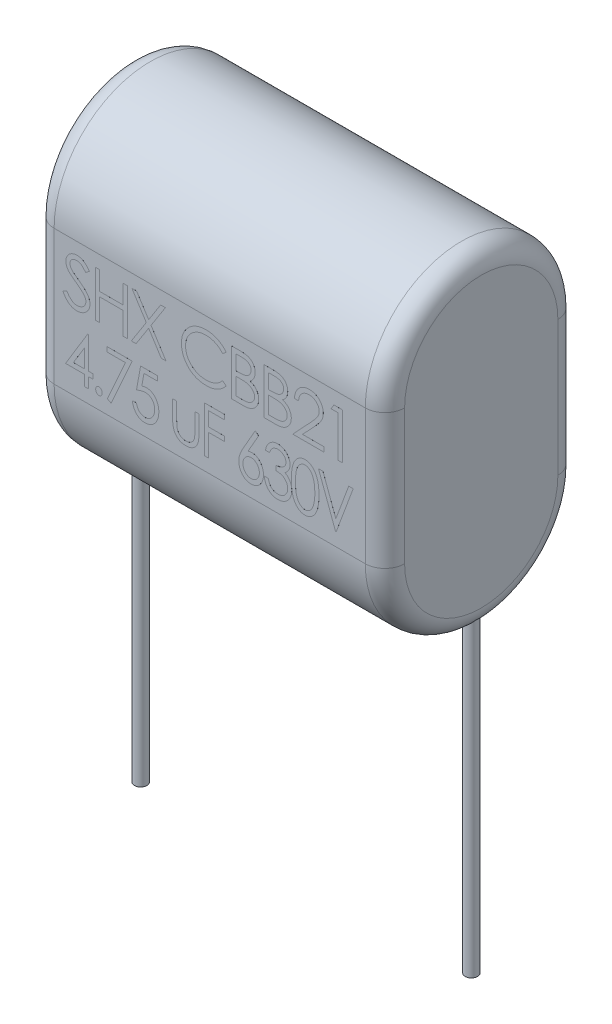
from build123d import *

# Parameters (mm, degrees)
BOSS_EXTRUDE1_DEPTH = 13.375
FILLET1_R           = 1.5
SKETCH2_R           = 0.47
BOSS_EXTRUDE3_DEPTH = 35.5
BOSS_EXTRUDE4_START = 7.35
BOSS_EXTRUDE4_DEPTH = 0.001


with BuildPart() as part:
    # Sketch1 → Boss-Extrude1 (new, symmetric)
    with BuildSketch(Plane(origin=(0, 0, 0), x_dir=(0, 0, -1), z_dir=(1, 0, 0))):
        with BuildLine():
            Line((7.35, 5.15), (7.35, -5.15))
            ThreePointArc((7.35, -5.15), (0, -12.5), (-7.35, -5.15))
            Line((-7.35, -5.15), (-7.35, 5.15))
            ThreePointArc((-7.35, 5.15), (0, 12.5), (7.35, 5.15))
        make_face()
    extrude(amount=BOSS_EXTRUDE1_DEPTH, both=True)

    # Fillet1
    fillet1_edges = [part.edges().sort_by_distance(p)[0] for p in [
        (13.375, -12.5, 0),
        (13.375, 0, -7.35),
        (13.375, 12.5, 0),
        (-13.375, 0, -7.35),
        (-13.375, -12.5, 0),
        (-13.375, 0, 7.35),
        (-13.375, 12.5, 0),
        (13.375, 0, 7.35),
    ]]
    fillet(fillet1_edges, radius=FILLET1_R)

    # Sketch2 → Boss-Extrude3 (add)
    with BuildSketch(Plane(origin=(0, 0, 0), x_dir=(1, 0, 0), z_dir=(0, 1, 0))):
        with Locations(Location((-12.62, 0, 0), (0, 0, 270))):
            Circle(SKETCH2_R)
        with Locations(Location((12.62, 0, 0), (0, 0, 129.320389194))):
            Circle(SKETCH2_R)
    extrude(amount=-BOSS_EXTRUDE3_DEPTH)

    # Sketch3 → Boss-Extrude4 (add)
    # profile 1 of 18: a face of its own
    with BuildSketch(Plane.XY.offset(BOSS_EXTRUDE4_START)):
        with BuildLine():
            Line((-11.2, 1.325180288), (-10.904126603, 1.502564103))
            add(Edge.make_bspline(
                [(-10.904126603, 1.502564103), (-10.876608365, 1.456499718), (-10.823884485, 1.368242134), (-10.735933126, 1.248984093), (-10.644800214, 1.147621937), (-10.549810881, 1.064745329), (-10.451544933, 0.999496442), (-10.349360879, 0.953294211), (-10.243603068, 0.924478235), (-10.171629247, 0.920978149), (-10.135697115, 0.919230769)],
                knots=[0, 0, 0, 0, 1.272034388, 2.437168799, 3.508375237, 4.49857839, 5.41946034, 6.295179144, 7.148887113, 8, 8, 8, 8], degree=3))
            add(Edge.make_bspline(
                [(-10.135697115, 0.919230769), (-10.105010255, 0.920085442), (-10.044173482, 0.921779832), (-9.954611239, 0.938060634), (-9.867629437, 0.963072763), (-9.785020799, 0.998893694), (-9.707925184, 1.04223218), (-9.640318489, 1.094578358), (-9.581872376, 1.153184563), (-9.534063261, 1.218567218), (-9.497383226, 1.288884367), (-9.469191158, 1.361060318), (-9.453546084, 1.436228886), (-9.45118933, 1.486839349), (-9.45, 1.512379808)],
                knots=[0, 0, 0, 0, 1.095163259, 2.171163733, 3.241058638, 4.321873601, 5.38011039, 6.391990106, 7.366004449, 8.327778327, 9.272591725, 10.192022065, 11.087607919, 12, 12, 12, 12], degree=3))
            add(Edge.make_bspline(
                [(-9.45, 1.512379808), (-9.451474311, 1.541520657), (-9.454471369, 1.600759747), (-9.479802849, 1.6881594), (-9.519652096, 1.77465197), (-9.55641474, 1.828153235), (-9.575500801, 1.855929487)],
                knots=[0, 0, 0, 0, 0.938893495, 1.908633276, 2.914225137, 4, 4, 4, 4], degree=3))
            add(Edge.make_bspline(
                [(-9.575500801, 1.855929487), (-9.591171415, 1.875976311), (-9.62406991, 1.918062109), (-9.680627422, 1.980707345), (-9.746993537, 2.045325764), (-9.820897092, 2.114384821), (-9.90503018, 2.184672617), (-9.996757695, 2.259540895), (-10.098421554, 2.336142472), (-10.16972105, 2.387515038), (-10.206510417, 2.414022436)],
                knots=[0, 0, 0, 0, 0.722233717, 1.516239348, 2.393582979, 3.351407094, 4.387010283, 5.505090956, 6.712668013, 8, 8, 8, 8], degree=3))
            add(Edge.make_bspline(
                [(-10.206510417, 2.414022436), (-10.243334413, 2.440251024), (-10.313739089, 2.490398086), (-10.412197672, 2.56482237), (-10.500242135, 2.632866239), (-10.577481151, 2.695170251), (-10.643880748, 2.751742856), (-10.699964159, 2.802040795), (-10.744302716, 2.847424356), (-10.768958297, 2.876865698), (-10.780028045, 2.890084135)],
                knots=[0, 0, 0, 0, 1.452282411, 2.77665338, 3.964542531, 5.026858415, 5.96415736, 6.766646006, 7.446254459, 8, 8, 8, 8], degree=3))
            add(Edge.make_bspline(
                [(-10.780028045, 2.890084135), (-10.79550059, 2.910685171), (-10.825929427, 2.951199875), (-10.866095432, 3.014524733), (-10.900234595, 3.079347998), (-10.926996927, 3.145843863), (-10.949533146, 3.213078792), (-10.964691077, 3.281930038), (-10.974182474, 3.352088656), (-10.97515446, 3.399302157), (-10.975641026, 3.422936699)],
                knots=[0, 0, 0, 0, 1.068054152, 2.10047183, 3.106115577, 4.101338837, 5.06977816, 6.043150881, 7.020423561, 8, 8, 8, 8], degree=3))
            add(Edge.make_bspline(
                [(-10.975641026, 3.422936699), (-10.974335817, 3.459966473), (-10.971753297, 3.533234537), (-10.949912779, 3.640265367), (-10.915439886, 3.742451785), (-10.867144998, 3.838782118), (-10.804887645, 3.926748099), (-10.732841671, 4.007361586), (-10.647030184, 4.075130168), (-10.552877561, 4.134342227), (-10.449821189, 4.180688152), (-10.341830286, 4.215649132), (-10.228733214, 4.23545839), (-10.152130079, 4.238301155), (-10.113261218, 4.23974359)],
                knots=[0, 0, 0, 0, 1.005424448, 1.989358655, 2.955360095, 3.929531133, 4.905563448, 5.876582895, 6.856512386, 7.866279853, 8.892233794, 9.918561126, 10.94386622, 12, 12, 12, 12], degree=3))
            add(Edge.make_bspline(
                [(-10.113261218, 4.23974359), (-10.072017118, 4.238321038), (-9.989995766, 4.235492037), (-9.86934655, 4.210894506), (-9.753185834, 4.170193834), (-9.659742569, 4.124005176), (-9.586609808, 4.07787376), (-9.530837075, 4.035853936), (-9.474319624, 3.987478827), (-9.416601569, 3.932619581), (-9.35866091, 3.87077283), (-9.299637458, 3.802362141), (-9.239393189, 3.727805585), (-9.200637329, 3.674581085), (-9.180769231, 3.647295673)],
                knots=[0, 0, 0, 0, 1.286793592, 2.559021753, 3.825965368, 5.121522368, 5.803751409, 6.523245864, 7.299691795, 8.125521123, 9.008227632, 9.944561021, 10.946284179, 12, 12, 12, 12], degree=3))
            Line((-9.180769231, 3.647295673), (-9.464723558, 3.432051282))
            add(Edge.make_bspline(
                [(-9.464723558, 3.432051282), (-9.48186949, 3.454139972), (-9.514888547, 3.496677626), (-9.565018034, 3.556248941), (-9.612266682, 3.610665421), (-9.658817082, 3.657930549), (-9.702210713, 3.700632682), (-9.744327756, 3.737192439), (-9.784562107, 3.767968034), (-9.835279017, 3.800811594), (-9.898996736, 3.833368098), (-9.978981272, 3.860917176), (-10.062567547, 3.877472238), (-10.119497178, 3.879661126), (-10.148317308, 3.880769231)],
                knots=[0, 0, 0, 0, 1.181633172, 2.275549214, 3.290209073, 4.226197932, 5.078386478, 5.862611352, 6.581680152, 7.217281963, 8.414376989, 9.595101626, 10.782541182, 12, 12, 12, 12], degree=3))
            add(Edge.make_bspline(
                [(-10.148317308, 3.880769231), (-10.18447383, 3.879557531), (-10.254198278, 3.877220882), (-10.353188514, 3.851700896), (-10.442282439, 3.811519036), (-10.518835004, 3.755204058), (-10.582571981, 3.688483065), (-10.62867744, 3.61170421), (-10.656427604, 3.526921808), (-10.659813884, 3.467780151), (-10.661538462, 3.437660256)],
                knots=[0, 0, 0, 0, 1.14458467, 2.207223713, 3.21896685, 4.227309161, 5.202851033, 6.127160689, 7.046193047, 8, 8, 8, 8], degree=3))
            add(Edge.make_bspline(
                [(-10.661538462, 3.437660256), (-10.661145335, 3.418908778), (-10.660358439, 3.381375158), (-10.649383641, 3.325923736), (-10.635284312, 3.270612397), (-10.61294168, 3.215689814), (-10.582096377, 3.160195455), (-10.541591201, 3.103173718), (-10.490577889, 3.044122009), (-10.451500876, 3.005714635), (-10.430869391, 2.985436699)],
                knots=[0, 0, 0, 0, 0.858281714, 1.717966888, 2.583508476, 3.4729293, 4.427298488, 5.488583878, 6.674047936, 8, 8, 8, 8], degree=3))
            add(Edge.make_bspline(
                [(-10.430869391, 2.985436699), (-10.423208019, 2.978599673), (-10.405006351, 2.962356465), (-10.371730426, 2.935764184), (-10.327787628, 2.902961412), (-10.274325426, 2.862374095), (-10.210358065, 2.815292633), (-10.135878508, 2.762319021), (-10.051716976, 2.701733562), (-9.99199506, 2.659376021), (-9.960416667, 2.636979167)],
                knots=[0, 0, 0, 0, 0.420754252, 0.999615792, 1.744751191, 2.668019286, 3.750313428, 4.999500688, 6.413464383, 8, 8, 8, 8], degree=3))
            add(Edge.make_bspline(
                [(-9.960416667, 2.636979167), (-9.922430753, 2.609337807), (-9.848876297, 2.555814145), (-9.744218717, 2.475398465), (-9.649324909, 2.396750697), (-9.563861705, 2.32037309), (-9.486984797, 2.246844997), (-9.419547076, 2.175281816), (-9.360861396, 2.106196244), (-9.297682177, 2.017623668), (-9.233124358, 1.908842584), (-9.177682851, 1.775564345), (-9.142724503, 1.641768025), (-9.138152988, 1.551841188), (-9.135897436, 1.507471955)],
                knots=[0, 0, 0, 0, 1.163667725, 2.253281268, 3.268753668, 4.215851969, 5.092017293, 5.902905408, 6.650798638, 7.335211899, 8.59617414, 9.77448103, 10.901945474, 12, 12, 12, 12], degree=3))
            add(Edge.make_bspline(
                [(-9.135897436, 1.507471955), (-9.136554574, 1.47609359), (-9.137856089, 1.413946206), (-9.152817003, 1.32269113), (-9.174736668, 1.23406026), (-9.207773902, 1.149149147), (-9.24809706, 1.066404385), (-9.299263308, 0.987996484), (-9.358570993, 0.912190086), (-9.426604758, 0.841006594), (-9.50105066, 0.775660398), (-9.579734355, 0.717531337), (-9.662784628, 0.669063014), (-9.749750944, 0.629512172), (-9.840653281, 0.598578654), (-9.935461065, 0.576165785), (-10.034330576, 0.562410074), (-10.101531058, 0.560982313), (-10.135697115, 0.56025641)],
                knots=[0, 0, 0, 0, 0.983748083, 1.948392443, 2.894712957, 3.844097841, 4.80183111, 5.778335162, 6.776009319, 7.81870978, 8.863265674, 9.881300176, 10.883814829, 11.87499822, 12.874611388, 13.892143829, 14.928324115, 16, 16, 16, 16], degree=3))
            add(Edge.make_bspline(
                [(-10.135697115, 0.56025641), (-10.162132458, 0.560767592), (-10.214670218, 0.561783517), (-10.2923797, 0.570764798), (-10.368519289, 0.583471901), (-10.442133572, 0.603645971), (-10.514170983, 0.628122948), (-10.584318218, 0.658261281), (-10.652609272, 0.694378482), (-10.719426854, 0.735673507), (-10.784601029, 0.783731252), (-10.847520497, 0.839704748), (-10.910249682, 0.902050253), (-10.970937079, 0.972460816), (-11.030810223, 1.049798899), (-11.088688633, 1.134788083), (-11.14577035, 1.226965436), (-11.181585818, 1.291830522), (-11.2, 1.325180288)],
                knots=[0, 0, 0, 0, 0.915332311, 1.819136955, 2.706846663, 3.586547465, 4.459518054, 5.340707479, 6.227863349, 7.133153174, 8.059268498, 9.028702269, 10.047606654, 11.120612155, 12.245963614, 13.433783089, 14.680604001, 16, 16, 16, 16], degree=3))
        make_face()
    # profile 2 of 18: a face of its own
    with BuildSketch(Plane.XY.offset(BOSS_EXTRUDE4_START)):
        Polygon((-8.714102564, 4.15), (-8.4, 4.15), (-8.4, 2.714102564), (-6.605128205, 2.714102564), (-6.605128205, 4.15), (-6.291025641, 4.15), (-6.291025641, 0.65), (-6.605128205, 0.65), (-6.605128205, 2.355128205), (-8.4, 2.355128205), (-8.4, 0.65), (-8.714102564, 0.65), align=None)
    # profile 3 of 18: a face of its own
    with BuildSketch(Plane.XY.offset(BOSS_EXTRUDE4_START)):
        Polygon((-5.936538462, 4.15), (-5.574058494, 4.15), (-4.657692308, 2.718309295), (-3.741326122, 4.15), (-3.378846154, 4.15), (-4.476101763, 2.43505609), (-3.333974359, 0.65), (-3.696454327, 0.65), (-4.657692308, 2.151802885), (-5.618930288, 0.65), (-5.981410256, 0.65), (-4.838581731, 2.43505609), align=None)
    # profile 4 of 18: a face of its own
    with BuildSketch(Plane.XY.offset(BOSS_EXTRUDE4_START)):
        with BuildLine():
            Line((1.256410256, 3.507772436), (0.981570513, 3.297435897))
            add(Edge.make_bspline(
                [(0.981570513, 3.297435897), (0.961964624, 3.320801867), (0.923017178, 3.367218783), (0.860357975, 3.432398327), (0.795056332, 3.493463589), (0.727137211, 3.550705469), (0.655378092, 3.602122234), (0.581517293, 3.650393337), (0.504319248, 3.693661075), (0.397567513, 3.746124061), (0.257919665, 3.800870216), (0.082124826, 3.846773448), (-0.101386273, 3.875994623), (-0.226583872, 3.879159465), (-0.290264423, 3.880769231)],
                knots=[0, 0, 0, 0, 0.757959112, 1.505699292, 2.245454638, 2.979532153, 3.711538275, 4.438200793, 5.171680507, 5.909471876, 7.393775596, 8.890124382, 10.418191784, 12, 12, 12, 12], degree=3))
            add(Edge.make_bspline(
                [(-0.290264423, 3.880769231), (-0.325347722, 3.880365268), (-0.395188715, 3.879561092), (-0.498837188, 3.868951967), (-0.60055024, 3.854040757), (-0.700261706, 3.831915434), (-0.797844664, 3.803942815), (-0.893937066, 3.770517401), (-0.987147666, 3.729162561), (-1.078765904, 3.683454301), (-1.166545115, 3.631826856), (-1.249600163, 3.575513504), (-1.327628131, 3.515144408), (-1.400690743, 3.450493302), (-1.468862692, 3.381851341), (-1.531650002, 3.308487), (-1.588835413, 3.230634826), (-1.641552438, 3.149321419), (-1.688765171, 3.064783627), (-1.72829505, 2.976708556), (-1.763300173, 2.886604453), (-1.790999415, 2.793453293), (-1.812923932, 2.697910527), (-1.828051595, 2.599719739), (-1.838540067, 2.499086059), (-1.839340244, 2.430876747), (-1.83974359, 2.396494391)],
                knots=[0, 0, 0, 0, 1.054917814, 2.100044995, 3.131103042, 4.146048494, 5.169673617, 6.183595914, 7.203665975, 8.234915748, 9.262203917, 10.264457458, 11.251630812, 12.227803204, 13.197192746, 14.159520551, 15.12972552, 16.100847026, 17.073214652, 18.039054194, 19.002613845, 19.979014051, 20.95965708, 21.949030935, 22.966165397, 24, 24, 24, 24], degree=3))
            add(Edge.make_bspline(
                [(-1.83974359, 2.396494391), (-1.838481771, 2.344763071), (-1.836004356, 2.243195486), (-1.813956022, 2.094424876), (-1.780450931, 1.951904202), (-1.730235354, 1.81652436), (-1.668316304, 1.686616002), (-1.590075692, 1.564377148), (-1.499459155, 1.447960584), (-1.395184735, 1.340117636), (-1.280778919, 1.241603911), (-1.158031008, 1.154853329), (-1.02724672, 1.082538447), (-0.88987009, 1.0223625), (-0.744843976, 0.976105772), (-0.592429173, 0.943541649), (-0.432957178, 0.922299468), (-0.323987778, 0.92026578), (-0.268529647, 0.919230769)],
                knots=[0, 0, 0, 0, 1.029171465, 2.020641659, 2.987623507, 3.938342917, 4.889210282, 5.84687017, 6.821220943, 7.821438502, 8.827599549, 9.822697543, 10.807740252, 11.797342354, 12.80366471, 13.83203677, 14.896651826, 16, 16, 16, 16], degree=3))
            add(Edge.make_bspline(
                [(-0.268529647, 0.919230769), (-0.207426958, 0.920919549), (-0.08716225, 0.924243472), (0.089205777, 0.952402721), (0.258041542, 0.998060638), (0.419354129, 1.061958561), (0.572688775, 1.145023849), (0.718285436, 1.245721726), (0.856267006, 1.365010059), (0.939238288, 1.456093187), (0.981570513, 1.502564103)],
                knots=[0, 0, 0, 0, 1.028121516, 2.023589091, 2.998037872, 3.967518031, 4.937445131, 5.927275754, 6.942489185, 8, 8, 8, 8], degree=3))
            Line((0.981570513, 1.502564103), (1.256410256, 1.294330929))
            add(Edge.make_bspline(
                [(1.256410256, 1.294330929), (1.234292147, 1.265792478), (1.190161871, 1.208852271), (1.118703854, 1.128580562), (1.043426557, 1.053076526), (0.963770847, 0.982948905), (0.880653055, 0.916794439), (0.792580743, 0.856492608), (0.70071171, 0.801201724), (0.605357232, 0.750574799), (0.506618619, 0.705657552), (0.404614184, 0.667203784), (0.299783608, 0.634078895), (0.1921221, 0.606826958), (0.081406343, 0.585555874), (-0.031964131, 0.571336199), (-0.148234006, 0.561594285), (-0.226675427, 0.560706369), (-0.266426282, 0.56025641)],
                knots=[0, 0, 0, 0, 0.986787822, 1.968848986, 2.935600012, 3.899624008, 4.868462664, 5.837806735, 6.815139263, 7.798259679, 8.787526145, 9.778297419, 10.776456485, 11.791383307, 12.812564526, 13.85620153, 14.913611965, 16, 16, 16, 16], degree=3))
            add(Edge.make_bspline(
                [(-0.266426282, 0.56025641), (-0.304069949, 0.560518403), (-0.378505639, 0.561036461), (-0.488404391, 0.569428628), (-0.595393972, 0.580878365), (-0.699168597, 0.598118496), (-0.800294573, 0.618462836), (-0.897855157, 0.645734093), (-0.992810367, 0.676283259), (-1.084778708, 0.712188246), (-1.173838408, 0.752704429), (-1.259702219, 0.798495987), (-1.342330652, 0.849177852), (-1.422536072, 0.903632863), (-1.499133656, 0.963610164), (-1.572787182, 1.028276799), (-1.643909658, 1.09741481), (-1.687912343, 1.147269663), (-1.710036058, 1.172335737)],
                knots=[0, 0, 0, 0, 1.114604814, 2.203992996, 3.262667896, 4.300477797, 5.318619304, 6.316056647, 7.298880507, 8.271930387, 9.238335007, 10.195173496, 11.151986948, 12.108099108, 13.064862484, 14.031167946, 15.010108607, 16, 16, 16, 16], degree=3))
            add(Edge.make_bspline(
                [(-1.710036058, 1.172335737), (-1.745471701, 1.215876926), (-1.815915178, 1.302433637), (-1.906040862, 1.442719618), (-1.983188417, 1.589187827), (-2.045564338, 1.742607755), (-2.094327071, 1.902635143), (-2.128108266, 2.069350657), (-2.15005987, 2.242598599), (-2.152570159, 2.360435388), (-2.153846154, 2.420332532)],
                knots=[0, 0, 0, 0, 0.994628077, 1.977248131, 2.950237994, 3.925870899, 4.908910175, 5.911660606, 6.938484602, 8, 8, 8, 8], degree=3))
            add(Edge.make_bspline(
                [(-2.153846154, 2.420332532), (-2.15229096, 2.483287986), (-2.149231214, 2.60714891), (-2.123235419, 2.788922863), (-2.081416622, 2.963074262), (-2.022019734, 3.129278007), (-1.946714382, 3.288408287), (-1.853687769, 3.439249492), (-1.744020626, 3.582766292), (-1.618573059, 3.716781043), (-1.481005723, 3.839320396), (-1.33368691, 3.947126599), (-1.176904963, 4.036844115), (-1.012387111, 4.111840278), (-0.838901429, 4.169484741), (-0.65681806, 4.209837928), (-0.466479145, 4.234955044), (-0.33661672, 4.238130252), (-0.270633013, 4.23974359)],
                knots=[0, 0, 0, 0, 1.032925535, 2.032216505, 3.007276963, 3.968222605, 4.92396291, 5.891752235, 6.871517503, 7.883894988, 8.900124299, 9.891468569, 10.874487609, 11.85992873, 12.854644235, 13.869047385, 14.917252991, 16, 16, 16, 16], degree=3))
            add(Edge.make_bspline(
                [(-0.270633013, 4.23974359), (-0.230418541, 4.239261452), (-0.150818044, 4.238307108), (-0.033065391, 4.229000965), (0.081576936, 4.213487359), (0.193187918, 4.192371289), (0.302310534, 4.166163968), (0.408110775, 4.13202367), (0.511209462, 4.092987138), (0.61095637, 4.048028672), (0.70687292, 3.997561931), (0.798929239, 3.942146307), (0.886394097, 3.881850502), (0.969882946, 3.817187326), (1.047999157, 3.746788767), (1.122960635, 3.672591171), (1.192221714, 3.592457347), (1.234974908, 3.536052413), (1.256410256, 3.507772436)],
                knots=[0, 0, 0, 0, 1.096760587, 2.17092713, 3.219439832, 4.250915756, 5.268269357, 6.278326846, 7.281116186, 8.274029601, 9.260640565, 10.235837813, 11.203064059, 12.156899882, 13.114053108, 14.069676657, 15.032185724, 16, 16, 16, 16], degree=3))
        make_face()
    # profile 5 of 18: a face of its own
    with BuildSketch(Plane.XY.offset(BOSS_EXTRUDE4_START)):
        with BuildLine():
            Line((1.678205128, 4.15), (2.361097756, 4.15))
            add(Edge.make_bspline(
                [(2.361097756, 4.15), (2.394526235, 4.14982425), (2.459318945, 4.149483602), (2.553538387, 4.14420047), (2.641787197, 4.136996801), (2.72409097, 4.125566708), (2.800411672, 4.111774931), (2.870979309, 4.095073115), (2.935569482, 4.075046501), (3.012682218, 4.04320022), (3.100602879, 3.995877051), (3.195801272, 3.925948486), (3.277205511, 3.840416023), (3.347391828, 3.743933368), (3.403192948, 3.637797596), (3.443562245, 3.524538407), (3.469120121, 3.405616665), (3.471748555, 3.323973487), (3.473076923, 3.28271234)],
                knots=[0, 0, 0, 0, 1.001505555, 1.941167018, 2.826882275, 3.653841531, 4.429895133, 5.150066043, 5.825578002, 6.45369114, 7.647487171, 8.808567382, 9.977351308, 11.170798116, 12.373658725, 13.556498008, 14.765093433, 16, 16, 16, 16], degree=3))
            add(Edge.make_bspline(
                [(3.473076923, 3.28271234), (3.471983705, 3.244059784), (3.469835427, 3.168103867), (3.449292668, 3.057009758), (3.417132, 2.951258539), (3.37242675, 2.851236154), (3.314324754, 2.75920254), (3.245466435, 2.674415274), (3.162389633, 2.600464217), (3.100146393, 2.559121315), (3.068529647, 2.538120994)],
                knots=[0, 0, 0, 0, 1.044552857, 2.05264487, 3.044412934, 4.028983338, 5.005914585, 5.980388656, 6.974128949, 8, 8, 8, 8], degree=3))
            add(Edge.make_bspline(
                [(3.068529647, 2.538120994), (3.108290075, 2.522855995), (3.184361622, 2.49365027), (3.289047635, 2.442014806), (3.37924248, 2.385852696), (3.455639626, 2.324520846), (3.520977281, 2.258412035), (3.578030222, 2.186556921), (3.626711596, 2.108018163), (3.66842452, 2.023614627), (3.700973276, 1.934208159), (3.72534918, 1.840637383), (3.73931663, 1.743237828), (3.741304271, 1.676952448), (3.742307692, 1.643489583)],
                knots=[0, 0, 0, 0, 1.27268992, 2.434971085, 3.483601985, 4.442670788, 5.356604649, 6.2567628, 7.179492994, 8.113709626, 9.066344395, 10.018646069, 10.999752585, 12, 12, 12, 12], degree=3))
            add(Edge.make_bspline(
                [(3.742307692, 1.643489583), (3.741330846, 1.609322711), (3.739408874, 1.542098433), (3.725228903, 1.443343299), (3.701219796, 1.348968352), (3.668148649, 1.258363169), (3.624986335, 1.171703035), (3.57245837, 1.088889771), (3.509826807, 1.01075544), (3.439763938, 0.936431817), (3.360501792, 0.86960403), (3.274986037, 0.810088323), (3.182139717, 0.761142261), (3.083487723, 0.720026239), (2.977923407, 0.688619041), (2.8659208, 0.666646467), (2.747576498, 0.65184143), (2.666366747, 0.650624225), (2.624719551, 0.65)],
                knots=[0, 0, 0, 0, 0.978564426, 1.925352924, 2.850884081, 3.763762016, 4.682927383, 5.618979971, 6.567305752, 7.547517671, 8.540179244, 9.531824382, 10.526200242, 11.540722885, 12.589160233, 13.674978461, 14.80764778, 16, 16, 16, 16], degree=3))
            Line((2.624719551, 0.65), (1.678205128, 0.65))
            Line((1.678205128, 0.65), (1.678205128, 4.15))
        make_face()
        with BuildLine():
            Line((1.992307692, 3.791025641), (1.992307692, 2.669230769))
            Line((1.992307692, 2.669230769), (2.203345353, 2.669230769))
            add(Edge.make_bspline(
                [(2.203345353, 2.669230769), (2.234194148, 2.669630692), (2.293800307, 2.670403425), (2.380120204, 2.672616942), (2.460245222, 2.678814985), (2.534037055, 2.685011248), (2.601379499, 2.695085835), (2.66212336, 2.707077958), (2.717221957, 2.719760863), (2.780761503, 2.74133035), (2.852834451, 2.773208025), (2.929667556, 2.822679861), (2.997402025, 2.881604215), (3.054599213, 2.949595176), (3.101410683, 3.024461362), (3.133924399, 3.105008243), (3.155971683, 3.189228375), (3.157963214, 3.247046627), (3.158974359, 3.276402244)],
                knots=[0, 0, 0, 0, 1.156816544, 2.235205308, 3.236616184, 4.169592532, 5.011045266, 5.787822928, 6.49130361, 7.128639758, 8.301311294, 9.436451833, 10.541879658, 11.654887649, 12.756523258, 13.837046038, 14.901820046, 16, 16, 16, 16], degree=3))
            add(Edge.make_bspline(
                [(3.158974359, 3.276402244), (3.158448179, 3.295828015), (3.157416019, 3.333933787), (3.148962716, 3.389483141), (3.134595142, 3.441726894), (3.116140849, 3.491381004), (3.09035216, 3.536892854), (3.059988697, 3.57983605), (3.023303006, 3.618748169), (2.981545694, 3.655117667), (2.933537071, 3.687362195), (2.879305779, 3.715602958), (2.818118102, 3.738343735), (2.751005247, 3.758259887), (2.676934159, 3.772248181), (2.596759606, 3.783901569), (2.509824887, 3.789834311), (2.449679784, 3.790619673), (2.418589744, 3.791025641)],
                knots=[0, 0, 0, 0, 0.91205012, 1.789085906, 2.630437955, 3.453916878, 4.269457761, 5.079663411, 5.91843418, 6.774407191, 7.675494373, 8.627863946, 9.638891023, 10.736472738, 11.911756761, 13.175263542, 14.539845004, 16, 16, 16, 16], degree=3))
            Line((2.418589744, 3.791025641), (1.992307692, 3.791025641))
        make_face(mode=Mode.SUBTRACT)
        with BuildLine():
            Line((1.992307692, 2.31025641), (1.992307692, 1.008974359))
            Line((1.992307692, 1.008974359), (2.439623397, 1.008974359))
            add(Edge.make_bspline(
                [(2.439623397, 1.008974359), (2.471642323, 1.009358106), (2.533354582, 1.010097729), (2.622455812, 1.012512283), (2.705038916, 1.018004559), (2.780727052, 1.026650409), (2.850337504, 1.036028858), (2.913035207, 1.048640139), (2.969328401, 1.063089099), (3.034602708, 1.085423272), (3.108106217, 1.120119743), (3.187317073, 1.172433969), (3.257743291, 1.234757277), (3.31754855, 1.306888191), (3.366561539, 1.385319518), (3.402216994, 1.468464868), (3.424207851, 1.554950395), (3.42687002, 1.613917108), (3.428205128, 1.643489583)],
                knots=[0, 0, 0, 0, 1.160039823, 2.235823828, 3.228722157, 4.157150951, 4.99529583, 5.772374946, 6.472645482, 7.099169577, 8.269452708, 9.405989375, 10.527446681, 11.663510218, 12.788923519, 13.866172445, 14.929861265, 16, 16, 16, 16], degree=3))
            add(Edge.make_bspline(
                [(3.428205128, 1.643489583), (3.427929024, 1.661982924), (3.427381269, 1.698671306), (3.419120654, 1.752587125), (3.407106784, 1.804812998), (3.39157535, 1.855490739), (3.368955883, 1.903704115), (3.342549338, 1.950406674), (3.311587936, 1.995660154), (3.263343771, 2.052872407), (3.193171786, 2.11878942), (3.093465011, 2.183326923), (2.980092713, 2.23537473), (2.89786522, 2.257474206), (2.855388622, 2.268890224)],
                knots=[0, 0, 0, 0, 0.723448775, 1.435228256, 2.130040452, 2.821711965, 3.505591119, 4.210454504, 4.921174351, 5.648778258, 7.137944449, 8.670945889, 10.280296675, 12, 12, 12, 12], degree=3))
            add(Edge.make_bspline(
                [(2.855388622, 2.268890224), (2.838359526, 2.272345308), (2.801436934, 2.279836643), (2.741229353, 2.287744346), (2.672493484, 2.294789406), (2.595070607, 2.300000564), (2.508862766, 2.305387107), (2.413685847, 2.307481929), (2.309928533, 2.309981189), (2.23793616, 2.310162323), (2.200540865, 2.31025641)],
                knots=[0, 0, 0, 0, 0.634451884, 1.375622551, 2.216452059, 3.157844607, 4.20941857, 5.370758133, 6.634282058, 8, 8, 8, 8], degree=3))
            Line((2.200540865, 2.31025641), (1.992307692, 2.31025641))
        make_face(mode=Mode.SUBTRACT)
    # profile 6 of 18: a face of its own
    with BuildSketch(Plane.XY.offset(BOSS_EXTRUDE4_START)):
        with BuildLine():
            Line((4.164102564, 4.15), (4.846995192, 4.15))
            add(Edge.make_bspline(
                [(4.846995192, 4.15), (4.88042367, 4.14982425), (4.945216381, 4.149483602), (5.039435823, 4.14420047), (5.127684633, 4.136996801), (5.209988406, 4.125566708), (5.286309108, 4.111774931), (5.356876745, 4.095073115), (5.421466918, 4.075046501), (5.498579654, 4.04320022), (5.586500315, 3.995877051), (5.681698708, 3.925948486), (5.763102947, 3.840416023), (5.833289264, 3.743933368), (5.889090384, 3.637797596), (5.929459681, 3.524538407), (5.955017556, 3.405616665), (5.957645991, 3.323973487), (5.958974359, 3.28271234)],
                knots=[0, 0, 0, 0, 1.001505555, 1.941167018, 2.826882275, 3.653841531, 4.429895133, 5.150066043, 5.825578002, 6.45369114, 7.647487171, 8.808567382, 9.977351308, 11.170798116, 12.373658725, 13.556498008, 14.765093433, 16, 16, 16, 16], degree=3))
            add(Edge.make_bspline(
                [(5.958974359, 3.28271234), (5.957881141, 3.244059784), (5.955732863, 3.168103867), (5.935190104, 3.057009758), (5.903029435, 2.951258539), (5.858324186, 2.851236154), (5.80022219, 2.75920254), (5.731363871, 2.674415274), (5.648287069, 2.600464217), (5.586043829, 2.559121315), (5.554427083, 2.538120994)],
                knots=[0, 0, 0, 0, 1.044552857, 2.05264487, 3.044412934, 4.028983338, 5.005914585, 5.980388656, 6.974128949, 8, 8, 8, 8], degree=3))
            add(Edge.make_bspline(
                [(5.554427083, 2.538120994), (5.594187511, 2.522855995), (5.670259058, 2.49365027), (5.774945071, 2.442014806), (5.865139916, 2.385852696), (5.941537062, 2.324520846), (6.006874717, 2.258412035), (6.063927658, 2.186556921), (6.112609032, 2.108018163), (6.154321956, 2.023614627), (6.186870712, 1.934208159), (6.211246616, 1.840637383), (6.225214065, 1.743237828), (6.227201707, 1.676952448), (6.228205128, 1.643489583)],
                knots=[0, 0, 0, 0, 1.27268992, 2.434971085, 3.483601985, 4.442670788, 5.356604649, 6.2567628, 7.179492994, 8.113709626, 9.066344395, 10.018646069, 10.999752585, 12, 12, 12, 12], degree=3))
            add(Edge.make_bspline(
                [(6.228205128, 1.643489583), (6.227228282, 1.609322711), (6.22530631, 1.542098433), (6.211126338, 1.443343299), (6.187117231, 1.348968352), (6.154046085, 1.258363169), (6.110883771, 1.171703035), (6.058355806, 1.088889771), (5.995724243, 1.01075544), (5.925661374, 0.936431817), (5.846399228, 0.86960403), (5.760883473, 0.810088323), (5.668037153, 0.761142261), (5.569385159, 0.720026239), (5.463820843, 0.688619041), (5.351818236, 0.666646467), (5.233473934, 0.65184143), (5.152264183, 0.650624225), (5.110616987, 0.65)],
                knots=[0, 0, 0, 0, 0.978564426, 1.925352924, 2.850884081, 3.763762016, 4.682927383, 5.618979971, 6.567305752, 7.547517671, 8.540179244, 9.531824382, 10.526200242, 11.540722885, 12.589160233, 13.674978461, 14.80764778, 16, 16, 16, 16], degree=3))
            Line((5.110616987, 0.65), (4.164102564, 0.65))
            Line((4.164102564, 0.65), (4.164102564, 4.15))
        make_face()
        with BuildLine():
            Line((4.478205128, 3.791025641), (4.478205128, 2.669230769))
            Line((4.478205128, 2.669230769), (4.689242788, 2.669230769))
            add(Edge.make_bspline(
                [(4.689242788, 2.669230769), (4.720091584, 2.669630692), (4.779697743, 2.670403425), (4.86601764, 2.672616942), (4.946142658, 2.678814985), (5.019934491, 2.685011248), (5.087276935, 2.695085835), (5.148020796, 2.707077958), (5.203119393, 2.719760863), (5.266658939, 2.74133035), (5.338731887, 2.773208025), (5.415564991, 2.822679861), (5.483299461, 2.881604215), (5.540496649, 2.949595176), (5.587308119, 3.024461362), (5.619821834, 3.105008243), (5.641869119, 3.189228375), (5.64386065, 3.247046627), (5.644871795, 3.276402244)],
                knots=[0, 0, 0, 0, 1.156816544, 2.235205308, 3.236616184, 4.169592532, 5.011045266, 5.787822928, 6.49130361, 7.128639758, 8.301311294, 9.436451833, 10.541879658, 11.654887649, 12.756523258, 13.837046038, 14.901820046, 16, 16, 16, 16], degree=3))
            add(Edge.make_bspline(
                [(5.644871795, 3.276402244), (5.644345615, 3.295828015), (5.643313455, 3.333933787), (5.634860152, 3.389483141), (5.620492578, 3.441726894), (5.602038285, 3.491381004), (5.576249596, 3.536892854), (5.545886133, 3.57983605), (5.509200442, 3.618748169), (5.46744313, 3.655117667), (5.419434507, 3.687362195), (5.365203215, 3.715602958), (5.304015538, 3.738343735), (5.236902683, 3.758259887), (5.162831595, 3.772248181), (5.082657042, 3.783901569), (4.995722323, 3.789834311), (4.93557722, 3.790619673), (4.904487179, 3.791025641)],
                knots=[0, 0, 0, 0, 0.91205012, 1.789085906, 2.630437955, 3.453916878, 4.269457761, 5.079663411, 5.91843418, 6.774407191, 7.675494373, 8.627863946, 9.638891023, 10.736472738, 11.911756761, 13.175263542, 14.539845004, 16, 16, 16, 16], degree=3))
            Line((4.904487179, 3.791025641), (4.478205128, 3.791025641))
        make_face(mode=Mode.SUBTRACT)
        with BuildLine():
            Line((4.478205128, 2.31025641), (4.478205128, 1.008974359))
            Line((4.478205128, 1.008974359), (4.925520833, 1.008974359))
            add(Edge.make_bspline(
                [(4.925520833, 1.008974359), (4.957539759, 1.009358106), (5.019252018, 1.010097729), (5.108353248, 1.012512283), (5.190936352, 1.018004559), (5.266624487, 1.026650409), (5.33623494, 1.036028858), (5.398932643, 1.048640139), (5.455225837, 1.063089099), (5.520500144, 1.085423272), (5.594003653, 1.120119743), (5.673214509, 1.172433969), (5.743640727, 1.234757277), (5.803445986, 1.306888191), (5.852458975, 1.385319518), (5.88811443, 1.468464868), (5.910105287, 1.554950395), (5.912767456, 1.613917108), (5.914102564, 1.643489583)],
                knots=[0, 0, 0, 0, 1.160039823, 2.235823828, 3.228722157, 4.157150951, 4.99529583, 5.772374946, 6.472645482, 7.099169577, 8.269452708, 9.405989375, 10.527446681, 11.663510218, 12.788923519, 13.866172445, 14.929861265, 16, 16, 16, 16], degree=3))
            add(Edge.make_bspline(
                [(5.914102564, 1.643489583), (5.91382646, 1.661982924), (5.913278705, 1.698671306), (5.90501809, 1.752587125), (5.89300422, 1.804812998), (5.877472786, 1.855490739), (5.854853319, 1.903704115), (5.828446774, 1.950406674), (5.797485372, 1.995660154), (5.749241206, 2.052872407), (5.679069222, 2.11878942), (5.579362446, 2.183326923), (5.465990149, 2.23537473), (5.383762656, 2.257474206), (5.341286058, 2.268890224)],
                knots=[0, 0, 0, 0, 0.723448775, 1.435228256, 2.130040452, 2.821711965, 3.505591119, 4.210454504, 4.921174351, 5.648778258, 7.137944449, 8.670945889, 10.280296675, 12, 12, 12, 12], degree=3))
            add(Edge.make_bspline(
                [(5.341286058, 2.268890224), (5.324256962, 2.272345308), (5.287334369, 2.279836643), (5.227126789, 2.287744346), (5.15839092, 2.294789406), (5.080968043, 2.300000564), (4.994760202, 2.305387107), (4.899583283, 2.307481929), (4.795825968, 2.309981189), (4.723833596, 2.310162323), (4.686438301, 2.31025641)],
                knots=[0, 0, 0, 0, 0.634451884, 1.375622551, 2.216452059, 3.157844607, 4.20941857, 5.370758133, 6.634282058, 8, 8, 8, 8], degree=3))
            Line((4.686438301, 2.31025641), (4.478205128, 2.31025641))
        make_face(mode=Mode.SUBTRACT)
    # profile 7 of 18: a face of its own
    with BuildSketch(Plane.XY.offset(BOSS_EXTRUDE4_START)):
        with BuildLine():
            Line((6.784615385, 3.073076923), (6.470512821, 3.073076923))
            add(Edge.make_bspline(
                [(6.470512821, 3.073076923), (6.472559974, 3.114747811), (6.476580528, 3.196588325), (6.495408817, 3.315912232), (6.522349694, 3.429967031), (6.560441148, 3.537836945), (6.607747426, 3.640475752), (6.664477453, 3.737475767), (6.731671304, 3.828466956), (6.807878038, 3.912605799), (6.890646677, 3.98979337), (6.979952616, 4.056448613), (7.073797644, 4.112766284), (7.171897043, 4.159847526), (7.275357606, 4.195187372), (7.383240464, 4.221409012), (7.4960196, 4.237185357), (7.572859622, 4.238881143), (7.611939103, 4.23974359)],
                knots=[0, 0, 0, 0, 1.10065271, 2.161652631, 3.183658789, 4.190468796, 5.17591951, 6.163126047, 7.15150782, 8.156236427, 9.156009102, 10.134482811, 11.092018607, 12.041330605, 13.001268258, 13.972401359, 14.968799086, 16, 16, 16, 16], degree=3))
            add(Edge.make_bspline(
                [(7.611939103, 4.23974359), (7.650317177, 4.238845133), (7.725728721, 4.237079698), (7.835790736, 4.221918669), (7.94056803, 4.198173078), (8.039855797, 4.164857661), (8.132861861, 4.120073234), (8.220284906, 4.066275695), (8.303165717, 4.004055864), (8.3777725, 3.93080205), (8.44628058, 3.852599666), (8.505382835, 3.769111762), (8.555995998, 3.682882477), (8.598183678, 3.593254275), (8.629239817, 3.499383247), (8.652818025, 3.402636044), (8.666145439, 3.302011233), (8.668190862, 3.233904677), (8.669230769, 3.199278846)],
                knots=[0, 0, 0, 0, 1.111607364, 2.184268762, 3.212621178, 4.221274766, 5.211760367, 6.196651075, 7.1921475, 8.207485113, 9.220403448, 10.201281604, 11.166441695, 12.114753415, 13.065576456, 14.026450734, 14.996634279, 16, 16, 16, 16], degree=3))
            add(Edge.make_bspline(
                [(8.669230769, 3.199278846), (8.667537506, 3.150531012), (8.664180695, 3.053890798), (8.635466318, 2.911875935), (8.590619807, 2.774282516), (8.536622451, 2.663545214), (8.482150006, 2.57431172), (8.433062499, 2.500843015), (8.375597688, 2.421737547), (8.30891919, 2.33726021), (8.234406318, 2.246749304), (8.151384154, 2.150259509), (8.059260672, 2.048787739), (7.994602172, 1.979482138), (7.961097756, 1.943569712)],
                knots=[0, 0, 0, 0, 1.184426356, 2.348067706, 3.509069118, 4.696110526, 5.333549288, 6.050745305, 6.844228056, 7.710549037, 8.667450064, 9.695053472, 10.805634456, 12, 12, 12, 12], degree=3))
            Line((7.961097756, 1.943569712), (7.085396635, 1.008974359))
            Line((7.085396635, 1.008974359), (8.714102564, 1.008974359))
            Line((8.714102564, 1.008974359), (8.714102564, 0.65))
            Line((8.714102564, 0.65), (6.335897436, 0.65))
            Line((6.335897436, 0.65), (7.693269231, 2.098517628))
            add(Edge.make_bspline(
                [(7.693269231, 2.098517628), (7.726317118, 2.133015935), (7.789795345, 2.199280121), (7.879577922, 2.296023081), (7.96021691, 2.385772622), (8.032234303, 2.468359171), (8.094067808, 2.544990738), (8.14894004, 2.613185442), (8.192905631, 2.675939892), (8.240621027, 2.748680506), (8.286835008, 2.837492823), (8.326547364, 2.946026513), (8.350762212, 3.057753765), (8.353667048, 3.133255802), (8.355128205, 3.171233974)],
                knots=[0, 0, 0, 0, 1.329631726, 2.553950428, 3.673215718, 4.687767853, 5.603093632, 6.413772471, 7.123043292, 7.734684054, 8.834405432, 9.900288307, 10.943827018, 12, 12, 12, 12], degree=3))
            add(Edge.make_bspline(
                [(8.355128205, 3.171233974), (8.354492463, 3.195115373), (8.353239537, 3.242181023), (8.342181839, 3.311186782), (8.325471333, 3.377751596), (8.301526075, 3.442080215), (8.269919335, 3.503525867), (8.231445955, 3.562163347), (8.187055892, 3.618852313), (8.135704622, 3.672005611), (8.079293103, 3.720686816), (8.019698853, 3.763810902), (7.956648749, 3.799850012), (7.890408627, 3.829393509), (7.821163157, 3.852568891), (7.748778412, 3.86862747), (7.673454396, 3.878709954), (7.6220209, 3.880074126), (7.595813301, 3.880769231)],
                knots=[0, 0, 0, 0, 0.991446411, 1.95395049, 2.89581595, 3.838931463, 4.798493298, 5.75982156, 6.748411868, 7.785213223, 8.824556874, 9.840280684, 10.836137867, 11.835679398, 12.848801643, 13.863922112, 14.911575587, 16, 16, 16, 16], degree=3))
            add(Edge.make_bspline(
                [(7.595813301, 3.880769231), (7.568442469, 3.880054199), (7.514690672, 3.878649993), (7.435771639, 3.868827329), (7.360485862, 3.851881489), (7.288643959, 3.828704814), (7.220124373, 3.799246266), (7.155260329, 3.762554521), (7.09419744, 3.718771028), (7.036820916, 3.669130471), (6.983956937, 3.61386287), (6.937510062, 3.552252907), (6.896926047, 3.485425492), (6.861516814, 3.413560941), (6.832761124, 3.336007161), (6.810787973, 3.253039456), (6.793401127, 3.165018075), (6.787592606, 3.10423299), (6.784615385, 3.073076923)],
                knots=[0, 0, 0, 0, 1.031018746, 2.02475058, 2.990194455, 3.934040569, 4.864654155, 5.795059489, 6.735614925, 7.690564532, 8.649604399, 9.611025574, 10.590972636, 11.591080095, 12.624614302, 13.701020113, 14.821632451, 16, 16, 16, 16], degree=3))
        make_face()
    # profile 8 of 18: a face of its own
    with BuildSketch(Plane.XY.offset(BOSS_EXTRUDE4_START)):
        Polygon((9.475941506, 4.15), (10.123076923, 4.15), (10.123076923, 0.65), (9.808974359, 0.65), (9.808974359, 3.791025641), (9.270512821, 3.791025641), align=None)
    # profile 9 of 18: a face of its own
    with BuildSketch(Plane.XY.offset(BOSS_EXTRUDE4_START)):
        Polygon((-9.311879006, -0.56025641), (-9.248076923, -0.56025641), (-9.248076923, -2.983333333), (-8.889102564, -2.983333333), (-8.889102564, -3.342307692), (-9.248076923, -3.342307692), (-9.248076923, -4.15), (-9.562179487, -4.15), (-9.562179487, -3.342307692), (-10.998076923, -3.342307692), align=None)
        Polygon((-9.562179487, -2.983333333), (-9.562179487, -1.601422276), (-10.39931891, -2.983333333), align=None, mode=Mode.SUBTRACT)
    # profile 10 of 18: a face of its own
    with BuildSketch(Plane.XY.offset(BOSS_EXTRUDE4_START)):
        with BuildLine():
            add(Edge.make_bspline(
                [(-8.453846154, -3.611538462), (-8.437368614, -3.612693616), (-8.404842337, -3.614973864), (-8.35779062, -3.631036105), (-8.315107193, -3.658474676), (-8.27771172, -3.695849249), (-8.246323924, -3.740123442), (-8.223722796, -3.790376993), (-8.208869471, -3.845099385), (-8.207668731, -3.883472658), (-8.207051282, -3.903205128)],
                knots=[0, 0, 0, 0, 0.932051743, 1.839848197, 2.779380411, 3.780329255, 4.815317283, 5.833513928, 6.885940208, 8, 8, 8, 8], degree=3))
            add(Edge.make_bspline(
                [(-8.207051282, -3.903205128), (-8.207707686, -3.922464057), (-8.208999224, -3.960357854), (-8.223688974, -4.01465327), (-8.246528706, -4.06497719), (-8.277474428, -4.109778332), (-8.315109663, -4.147285085), (-8.357931318, -4.174482187), (-8.404693533, -4.191641675), (-8.437344339, -4.19378736), (-8.453846154, -4.194871795)],
                knots=[0, 0, 0, 0, 1.089197406, 2.143100788, 3.162726492, 4.210031689, 5.212385385, 6.153236251, 7.066640104, 8, 8, 8, 8], degree=3))
            add(Edge.make_bspline(
                [(-8.453846154, -4.194871795), (-8.470347969, -4.19378736), (-8.502998775, -4.191641675), (-8.54976099, -4.174482187), (-8.592582645, -4.147285085), (-8.63021788, -4.109778332), (-8.661163602, -4.06497719), (-8.684003334, -4.01465327), (-8.698693084, -3.960357854), (-8.699984622, -3.922464057), (-8.700641026, -3.903205128)],
                knots=[0, 0, 0, 0, 0.933359896, 1.846763749, 2.787614615, 3.789968311, 4.837273508, 5.856899212, 6.910802594, 8, 8, 8, 8], degree=3))
            add(Edge.make_bspline(
                [(-8.700641026, -3.903205128), (-8.700023576, -3.883472658), (-8.698822837, -3.845099385), (-8.683969512, -3.790376993), (-8.661368384, -3.740123442), (-8.629980588, -3.695849249), (-8.592585115, -3.658474676), (-8.549901688, -3.631036105), (-8.50284997, -3.614973864), (-8.470323694, -3.612693616), (-8.453846154, -3.611538462)],
                knots=[0, 0, 0, 0, 1.114059792, 2.166486072, 3.184682717, 4.219670745, 5.220619589, 6.160151803, 7.067948257, 8, 8, 8, 8], degree=3))
        make_face()
    # profile 11 of 18: a face of its own
    with BuildSketch(Plane.XY.offset(BOSS_EXTRUDE4_START)):
        Polygon((-7.839102564, -0.65), (-5.909615385, -0.65), (-7.525, -4.23974359), (-7.808253205, -4.084795673), (-6.424238782, -1.008974359), (-7.839102564, -1.008974359), align=None)
    # profile 12 of 18: a face of its own
    with BuildSketch(Plane.XY.offset(BOSS_EXTRUDE4_START)):
        with BuildLine():
            Line((-3.971153846, -0.65), (-3.971153846, -1.008974359))
            Line((-3.971153846, -1.008974359), (-5.016526442, -1.008974359))
            Line((-5.016526442, -1.008974359), (-5.182692308, -1.93515625))
            add(Edge.make_bspline(
                [(-5.182692308, -1.93515625), (-5.150831283, -1.923907994), (-5.089400619, -1.902220435), (-4.998000025, -1.878875998), (-4.911315574, -1.86498965), (-4.855079233, -1.862662271), (-4.827924679, -1.861538462)],
                knots=[0, 0, 0, 0, 1.113143318, 2.146231409, 3.104880253, 4, 4, 4, 4], degree=3))
            add(Edge.make_bspline(
                [(-4.827924679, -1.861538462), (-4.794207712, -1.862379056), (-4.728040147, -1.864028673), (-4.63140231, -1.880035159), (-4.539295521, -1.905470677), (-4.451553847, -1.940263125), (-4.368406224, -1.985991343), (-4.289889234, -2.04150627), (-4.215636519, -2.107171985), (-4.147700998, -2.183108276), (-4.084828589, -2.265446566), (-4.030434017, -2.354898053), (-3.984317417, -2.449511096), (-3.945834645, -2.549755441), (-3.917697315, -2.656146855), (-3.896527043, -2.767871753), (-3.883714686, -2.885346132), (-3.882188977, -2.965539627), (-3.881410256, -3.006470353)],
                knots=[0, 0, 0, 0, 0.973560614, 1.910555428, 2.821466426, 3.73059852, 4.631163213, 5.556699778, 6.503883695, 7.488691105, 8.49622651, 9.493389215, 10.5081404, 11.534042417, 12.590644417, 13.683294485, 14.817554483, 16, 16, 16, 16], degree=3))
            add(Edge.make_bspline(
                [(-3.881410256, -3.006470353), (-3.88323681, -3.063121502), (-3.886834016, -3.174690009), (-3.913049389, -3.338357032), (-3.957653761, -3.494722215), (-4.009165042, -3.618425792), (-4.057668791, -3.712386061), (-4.097815466, -3.778219313), (-4.140496251, -3.840340973), (-4.186920819, -3.897761312), (-4.236055104, -3.951209206), (-4.288115496, -4.000621174), (-4.343645354, -4.045683472), (-4.402566965, -4.085910029), (-4.46338588, -4.12303542), (-4.527667605, -4.153407252), (-4.593514377, -4.180379499), (-4.661964392, -4.202172937), (-4.732757359, -4.219003373), (-4.805910019, -4.230550476), (-4.881248038, -4.238987725), (-4.932367242, -4.239488978), (-4.958333333, -4.23974359)],
                knots=[0, 0, 0, 0, 1.854240742, 3.651732996, 5.409993055, 7.166221002, 8.028594238, 8.869695635, 9.688937347, 10.494306344, 11.284856283, 12.064219686, 12.842117024, 13.623131146, 14.398616627, 15.171985563, 15.947735206, 16.72687324, 17.521153864, 18.327430933, 19.15041553, 20, 20, 20, 20], degree=3))
            add(Edge.make_bspline(
                [(-4.958333333, -4.23974359), (-4.989007164, -4.239047738), (-5.049486368, -4.237675736), (-5.138119478, -4.22343175), (-5.223656288, -4.202966476), (-5.305124652, -4.172458448), (-5.383108845, -4.133735564), (-5.456609153, -4.085486641), (-5.527441416, -4.029886863), (-5.593528597, -3.96559848), (-5.65416225, -3.894190059), (-5.709065415, -3.817513939), (-5.757739285, -3.735720123), (-5.799662387, -3.648906068), (-5.834944044, -3.55693596), (-5.863443507, -3.460062638), (-5.886189211, -3.358177384), (-5.895768379, -3.288173211), (-5.900641026, -3.252564103)],
                knots=[0, 0, 0, 0, 0.980012484, 1.932278219, 2.86391096, 3.788442921, 4.707522156, 5.642386417, 6.594769441, 7.583067065, 8.584946701, 9.586603339, 10.595260768, 11.624716315, 12.665609409, 13.74146141, 14.851146399, 16, 16, 16, 16], degree=3))
            Line((-5.900641026, -3.252564103), (-5.586538462, -3.252564103))
            add(Edge.make_bspline(
                [(-5.586538462, -3.252564103), (-5.580186529, -3.285911032), (-5.568020159, -3.349783111), (-5.539982304, -3.439437276), (-5.507822451, -3.520206474), (-5.467243516, -3.591100452), (-5.420270308, -3.653902746), (-5.366305366, -3.709607589), (-5.306000823, -3.759810846), (-5.238591852, -3.802097405), (-5.167400967, -3.837329851), (-5.092719992, -3.861659141), (-5.016783539, -3.878179444), (-4.965196897, -3.879905957), (-4.939403045, -3.880769231)],
                knots=[0, 0, 0, 0, 1.237908536, 2.371066588, 3.422813746, 4.404583581, 5.342816831, 6.277826636, 7.229035638, 8.199176782, 9.175745742, 10.119776575, 11.059868941, 12, 12, 12, 12], degree=3))
            add(Edge.make_bspline(
                [(-4.939403045, -3.880769231), (-4.914342908, -3.879947764), (-4.864871447, -3.878326097), (-4.792048478, -3.865785452), (-4.72162966, -3.846743419), (-4.654723856, -3.817610012), (-4.589360868, -3.783240022), (-4.528699617, -3.73781298), (-4.469102559, -3.686777745), (-4.413862399, -3.627425198), (-4.362813552, -3.56256328), (-4.317661327, -3.493018253), (-4.279850736, -3.419169792), (-4.248732042, -3.341522515), (-4.224938964, -3.260013429), (-4.208370276, -3.174563452), (-4.197371562, -3.085281146), (-4.196140594, -3.024265859), (-4.195512821, -2.993149038)],
                knots=[0, 0, 0, 0, 0.933673813, 1.843174603, 2.747905908, 3.645942738, 4.55819341, 5.494019063, 6.463585747, 7.480531844, 8.510567353, 9.537614091, 10.566285436, 11.598455736, 12.651591861, 13.726309059, 14.840453956, 16, 16, 16, 16], degree=3))
            add(Edge.make_bspline(
                [(-4.195512821, -2.993149038), (-4.195889416, -2.965068375), (-4.196626264, -2.910125592), (-4.207128038, -2.830009427), (-4.222108681, -2.753888111), (-4.244025366, -2.681803938), (-4.272186666, -2.613844677), (-4.305693096, -2.549257704), (-4.346789605, -2.489754273), (-4.393065744, -2.434412463), (-4.443864562, -2.38363767), (-4.500167126, -2.340207209), (-4.560603068, -2.303633537), (-4.624438009, -2.271959225), (-4.693592084, -2.249560793), (-4.766218669, -2.232332939), (-4.843088438, -2.222622586), (-4.895674099, -2.221226855), (-4.922576122, -2.220512821)],
                knots=[0, 0, 0, 0, 1.127360635, 2.20580017, 3.240687026, 4.241666562, 5.226843905, 6.192863443, 7.15906549, 8.125632452, 9.088360914, 10.038692719, 10.974299228, 11.923377817, 12.894313054, 13.887334147, 14.919192329, 16, 16, 16, 16], degree=3))
            add(Edge.make_bspline(
                [(-4.922576122, -2.220512821), (-4.945968721, -2.221094244), (-4.994295923, -2.222295417), (-5.068324446, -2.231118046), (-5.146009816, -2.245368467), (-5.22721638, -2.265085178), (-5.312132417, -2.290446146), (-5.400668797, -2.321646958), (-5.492988451, -2.357740613), (-5.55487413, -2.385696258), (-5.586538462, -2.4)],
                knots=[0, 0, 0, 0, 0.810269167, 1.673950008, 2.579134618, 3.545268136, 4.567349434, 5.647883586, 6.7965197, 8, 8, 8, 8], degree=3))
            Line((-5.586538462, -2.4), (-5.272435897, -0.65))
            Line((-5.272435897, -0.65), (-3.971153846, -0.65))
        make_face()
    # profile 13 of 18: a face of its own
    with BuildSketch(Plane.XY.offset(BOSS_EXTRUDE4_START)):
        with BuildLine():
            Line((-2.831410256, -1.592307692), (-2.517307692, -1.592307692))
            Line((-2.517307692, -1.592307692), (-2.517307692, -2.778605769))
            add(Edge.make_bspline(
                [(-2.517307692, -2.778605769), (-2.517216973, -2.813430502), (-2.517043432, -2.880048585), (-2.514535248, -2.97585922), (-2.51243102, -3.063328004), (-2.507093633, -3.142292606), (-2.501813647, -3.212937667), (-2.494928774, -3.274922349), (-2.486825004, -3.328810153), (-2.479388729, -3.361505932), (-2.475941506, -3.37666266)],
                knots=[0, 0, 0, 0, 1.391532709, 2.661936892, 3.829901352, 4.887223925, 5.824101155, 6.660496541, 7.379048576, 8, 8, 8, 8], degree=3))
            add(Edge.make_bspline(
                [(-2.475941506, -3.37666266), (-2.464304541, -3.414071158), (-2.441620135, -3.486993049), (-2.38764143, -3.5865404), (-2.320536346, -3.674046457), (-2.23936492, -3.748137718), (-2.146548897, -3.806775283), (-2.044806969, -3.85060648), (-1.933825531, -3.87620679), (-1.856983245, -3.879222931), (-1.817588141, -3.880769231)],
                knots=[0, 0, 0, 0, 1.047486636, 2.041907865, 3.014989621, 3.990003216, 4.969629675, 5.943033671, 6.945445186, 8, 8, 8, 8], degree=3))
            add(Edge.make_bspline(
                [(-1.817588141, -3.880769231), (-1.778429271, -3.879188005), (-1.702334194, -3.876115304), (-1.592863214, -3.851279229), (-1.492905445, -3.809168941), (-1.403148059, -3.751378714), (-1.324047925, -3.680458684), (-1.258780348, -3.597189093), (-1.204431369, -3.504669887), (-1.181438007, -3.436533465), (-1.169751603, -3.401903045)],
                knots=[0, 0, 0, 0, 1.083224142, 2.104964324, 3.087867758, 4.071345921, 5.047068855, 6.014022567, 6.990624521, 8, 8, 8, 8], degree=3))
            add(Edge.make_bspline(
                [(-1.169751603, -3.401903045), (-1.165983308, -3.387936118), (-1.157647316, -3.357039335), (-1.150231488, -3.304541516), (-1.142275271, -3.242194586), (-1.136025403, -3.169222519), (-1.132412871, -3.085948088), (-1.128628824, -2.992476003), (-1.126665542, -2.888923833), (-1.126413665, -2.81646696), (-1.126282051, -2.778605769)],
                knots=[0, 0, 0, 0, 0.553958893, 1.225434092, 2.028671365, 2.963679295, 4.030914419, 5.223034872, 6.548940879, 8, 8, 8, 8], degree=3))
            Line((-1.126282051, -2.778605769), (-1.126282051, -1.592307692))
            Line((-1.126282051, -1.592307692), (-0.812179487, -1.592307692))
            Line((-0.812179487, -1.592307692), (-0.812179487, -2.8375))
            add(Edge.make_bspline(
                [(-0.812179487, -2.8375), (-0.812282218, -2.879810977), (-0.812481537, -2.961903094), (-0.818759677, -3.08110327), (-0.826243497, -3.192304359), (-0.839469671, -3.295342676), (-0.854276108, -3.390216876), (-0.872990322, -3.477222924), (-0.896318976, -3.555750473), (-0.930053378, -3.649046916), (-0.982485836, -3.75420882), (-1.05995983, -3.86659293), (-1.151646076, -3.964893595), (-1.239366356, -4.034046664), (-1.316310585, -4.080956137), (-1.377613247, -4.111819136), (-1.442840787, -4.136936588), (-1.511221237, -4.15809663), (-1.583354074, -4.174934675), (-1.659054552, -4.186642491), (-1.738217559, -4.19390984), (-1.792097731, -4.194545998), (-1.819691506, -4.194871795)],
                knots=[0, 0, 0, 0, 1.312098829, 2.54574533, 3.701569955, 4.767896179, 5.766537578, 6.679358675, 7.525722669, 8.305423759, 9.754479426, 11.155959474, 12.525277459, 13.908701379, 14.604880684, 15.31806066, 16.034181596, 16.770167898, 17.536786682, 18.329287869, 19.144374379, 20, 20, 20, 20], degree=3))
            add(Edge.make_bspline(
                [(-1.819691506, -4.194871795), (-1.847283952, -4.1945329), (-1.901394367, -4.193868308), (-1.98057683, -4.186757556), (-2.056252112, -4.174859291), (-2.128367948, -4.158003953), (-2.197221319, -4.136913373), (-2.263019113, -4.112007753), (-2.324587328, -4.080749881), (-2.402222348, -4.034256708), (-2.490643872, -3.964808961), (-2.583222442, -3.866024245), (-2.660205825, -3.751813815), (-2.71359304, -3.645897397), (-2.747343247, -3.551320713), (-2.770794816, -3.471175168), (-2.78909529, -3.382218585), (-2.8043322, -3.284851516), (-2.817208185, -3.179427548), (-2.824904578, -3.06521561), (-2.831100615, -2.942735779), (-2.83130482, -2.85807548), (-2.831410256, -2.814362981)],
                knots=[0, 0, 0, 0, 0.844445595, 1.656007694, 2.431087477, 3.187689243, 3.920896429, 4.634327057, 5.338188272, 6.031389025, 7.402366307, 8.763903704, 10.158861678, 11.604980077, 12.381214554, 13.230253831, 14.159118366, 15.158838041, 16.246741172, 17.408865503, 18.662124194, 20, 20, 20, 20], degree=3))
            Line((-2.831410256, -2.814362981), (-2.831410256, -1.592307692))
        make_face()
    # profile 14 of 18: a face of its own
    with BuildSketch(Plane.XY.offset(BOSS_EXTRUDE4_START)):
        Polygon((-0.399358974, -0.65), (1.126282051, -0.65), (1.126282051, -1.008974359), (-0.08525641, -1.008974359), (-0.08525641, -2.085897436), (1.126282051, -2.085897436), (1.126282051, -2.444871795), (-0.08525641, -2.444871795), (-0.08525641, -4.15), (-0.399358974, -4.15), align=None)
    # profile 15 of 18: a face of its own
    with BuildSketch(Plane.XY.offset(BOSS_EXTRUDE4_START)):
        with BuildLine():
            Line((3.477564103, -0.56025641), (3.736278045, -0.762880609))
            Line((3.736278045, -0.762880609), (2.929286859, -2.17353766))
            add(Edge.make_bspline(
                [(2.929286859, -2.17353766), (2.956556224, -2.166877195), (3.00984844, -2.153860721), (3.089270778, -2.140656009), (3.16586689, -2.132652531), (3.216027729, -2.131388206), (3.240584936, -2.130769231)],
                knots=[0, 0, 0, 0, 1.069017442, 2.089168874, 3.064515738, 4, 4, 4, 4], degree=3))
            add(Edge.make_bspline(
                [(3.240584936, -2.130769231), (3.270087953, -2.131745649), (3.328494123, -2.133678632), (3.4141215, -2.148042472), (3.496564065, -2.171220299), (3.575288575, -2.204479066), (3.650725523, -2.246867025), (3.722826861, -2.298414673), (3.790787399, -2.359953745), (3.854932811, -2.429618346), (3.913091594, -2.506439045), (3.965699092, -2.587404002), (4.008044586, -2.673989099), (4.044634397, -2.763884495), (4.071213512, -2.859071634), (4.092288828, -2.957997922), (4.10299199, -3.061624566), (4.104832782, -3.13195158), (4.105769231, -3.167728365)],
                knots=[0, 0, 0, 0, 0.94270807, 1.866248726, 2.767185609, 3.674541525, 4.590954703, 5.527962652, 6.501338954, 7.516419256, 8.550346355, 9.578210583, 10.597159334, 11.626461306, 12.676190005, 13.75154867, 14.856166998, 16, 16, 16, 16], degree=3))
            add(Edge.make_bspline(
                [(4.105769231, -3.167728365), (4.10436438, -3.216672653), (4.101605504, -3.312790526), (4.077624299, -3.452953172), (4.039973713, -3.586426218), (3.986033241, -3.711470023), (3.918158943, -3.826865818), (3.836643297, -3.930248577), (3.742689218, -4.021738157), (3.636449255, -4.098916792), (3.521913551, -4.161313888), (3.401511449, -4.206907643), (3.276406183, -4.234348427), (3.191405555, -4.23794049), (3.148737981, -4.23974359)],
                knots=[0, 0, 0, 0, 1.100029193, 2.160261625, 3.188348283, 4.212531226, 5.214007029, 6.19084986, 7.16470451, 8.153968429, 9.134706228, 10.089452316, 11.040966659, 12, 12, 12, 12], degree=3))
            add(Edge.make_bspline(
                [(3.148737981, -4.23974359), (3.107470192, -4.238200197), (3.025502776, -4.235134661), (2.905137534, -4.208189229), (2.789744391, -4.16398224), (2.67963934, -4.103926072), (2.578012038, -4.027265503), (2.486698724, -3.936109423), (2.407754779, -3.830254705), (2.341071489, -3.712085579), (2.287393998, -3.585069948), (2.249609128, -3.451741691), (2.225438574, -3.314440871), (2.222590482, -3.221114296), (2.221153846, -3.174038462)],
                knots=[0, 0, 0, 0, 0.944369752, 1.875737749, 2.809318535, 3.767620574, 4.738711332, 5.715334409, 6.713191694, 7.753677133, 8.816521235, 9.863637142, 10.922374871, 12, 12, 12, 12], degree=3))
            add(Edge.make_bspline(
                [(2.221153846, -3.174038462), (2.2221906, -3.138006413), (2.224305091, -3.064517968), (2.238940687, -2.953170298), (2.262322203, -2.839133098), (2.294968027, -2.720543966), (2.340824163, -2.594981818), (2.401397275, -2.459364213), (2.475666028, -2.311423386), (2.533131777, -2.210432206), (2.563301282, -2.157411859)],
                knots=[0, 0, 0, 0, 0.796578147, 1.624645084, 2.47893077, 3.369018653, 4.341574185, 5.431288296, 6.651426929, 8, 8, 8, 8], degree=3))
            Line((2.563301282, -2.157411859), (3.477564103, -0.56025641))
        make_face()
        with BuildLine():
            add(Edge.make_bspline(
                [(3.162760417, -2.48974359), (3.141470127, -2.490540576), (3.099399328, -2.492115465), (3.037381747, -2.50090929), (2.978201544, -2.517702797), (2.920877144, -2.538954772), (2.866635894, -2.568368243), (2.814519265, -2.603605839), (2.764613386, -2.645061495), (2.718178262, -2.692516632), (2.675411006, -2.744308462), (2.637694393, -2.799351125), (2.605655074, -2.85722405), (2.580653115, -2.918143055), (2.560065749, -2.98134046), (2.545341436, -3.04727261), (2.536801877, -3.116085829), (2.53577897, -3.16279628), (2.53525641, -3.186658654)],
                knots=[0, 0, 0, 0, 0.980440822, 1.937405712, 2.874327233, 3.807349667, 4.745813954, 5.706580769, 6.699688098, 7.726654196, 8.758342519, 9.787784865, 10.794031938, 11.796995789, 12.814224172, 13.850389844, 14.90185603, 16, 16, 16, 16], degree=3))
            add(Edge.make_bspline(
                [(2.53525641, -3.186658654), (2.535772414, -3.210289119), (2.536782307, -3.256537288), (2.545439952, -3.324857878), (2.559919255, -3.390389553), (2.580839222, -3.453237375), (2.605443679, -3.513869486), (2.637921785, -3.571270087), (2.675379615, -3.626222867), (2.718190382, -3.677983774), (2.764596571, -3.72548191), (2.814572023, -3.766802224), (2.866531173, -3.802573376), (2.921809791, -3.830326696), (2.978692232, -3.853089729), (3.038118012, -3.8695209), (3.100091333, -3.878418792), (3.142168185, -3.879979448), (3.163461538, -3.880769231)],
                knots=[0, 0, 0, 0, 1.089616321, 2.132533514, 3.170816366, 4.179868319, 5.184881509, 6.183747772, 7.21529356, 8.249089914, 9.278154394, 10.273290922, 11.236020856, 12.180963788, 13.119799704, 14.05863562, 15.017555861, 16, 16, 16, 16], degree=3))
            add(Edge.make_bspline(
                [(3.163461538, -3.880769231), (3.184754538, -3.879978753), (3.226830691, -3.878416724), (3.288809127, -3.869528872), (3.348215957, -3.85306051), (3.404975781, -3.830512947), (3.459814421, -3.802358181), (3.51165132, -3.76681985), (3.561672298, -3.725514927), (3.607939096, -3.677719816), (3.65168773, -3.626685644), (3.688219619, -3.571036485), (3.720660065, -3.513735895), (3.746255997, -3.453405298), (3.766948259, -3.390367105), (3.781498173, -3.324863958), (3.790136804, -3.256535685), (3.791149322, -3.210288577), (3.791666667, -3.186658654)],
                knots=[0, 0, 0, 0, 0.982721893, 1.941913238, 2.881014579, 3.820115919, 4.755744149, 5.718746264, 6.714164134, 7.743519548, 8.78450012, 9.810291293, 10.809439953, 11.81894996, 12.82828719, 13.866863582, 14.910075626, 16, 16, 16, 16], degree=3))
            add(Edge.make_bspline(
                [(3.791666667, -3.186658654), (3.791142749, -3.162796829), (3.790117182, -3.116087452), (3.781596827, -3.047266474), (3.766801654, -2.981362953), (3.746444542, -2.91797418), (3.720446272, -2.85735864), (3.688444083, -2.799586804), (3.65165628, -2.743845316), (3.607950187, -2.692782743), (3.561659615, -2.645020236), (3.511689385, -2.603617463), (3.459590557, -2.568361289), (3.405339739, -2.538970986), (3.34782443, -2.517566136), (3.288343024, -2.501015601), (3.226126678, -2.492096212), (3.184052444, -2.490534106), (3.162760417, -2.48974359)],
                knots=[0, 0, 0, 0, 1.097086186, 2.147539549, 3.182707137, 4.198955676, 5.20515228, 6.210430088, 7.232854421, 8.270418297, 9.296395173, 10.288545893, 11.248387252, 12.185947565, 13.118071268, 14.064460489, 15.020503586, 16, 16, 16, 16], degree=3))
        make_face(mode=Mode.SUBTRACT)
    # profile 16 of 18: a face of its own
    with BuildSketch(Plane.XY.offset(BOSS_EXTRUDE4_START)):
        with BuildLine():
            Line((4.563461538, -1.457692308), (4.249358974, -1.457692308))
            add(Edge.make_bspline(
                [(4.249358974, -1.457692308), (4.257317868, -1.422519843), (4.272832977, -1.353954463), (4.303270164, -1.255074749), (4.33892185, -1.162545234), (4.379629433, -1.076049636), (4.425067674, -0.995512972), (4.476798016, -0.921827204), (4.532425442, -0.853199602), (4.594678489, -0.792709793), (4.659465913, -0.737470976), (4.728538013, -0.690810767), (4.799815055, -0.650201352), (4.874212318, -0.617150612), (4.951829659, -0.591933459), (5.032308815, -0.573708217), (5.115604344, -0.562059741), (5.172230601, -0.560860873), (5.20078125, -0.56025641)],
                knots=[0, 0, 0, 0, 1.213646873, 2.365889363, 3.479226314, 4.54912843, 5.581579656, 6.587705624, 7.576924878, 8.55050232, 9.505464024, 10.439453725, 11.351887816, 12.264152294, 13.174752891, 14.094686289, 15.039351257, 16, 16, 16, 16], degree=3))
            add(Edge.make_bspline(
                [(5.20078125, -0.56025641), (5.242499081, -0.561648742), (5.325230328, -0.564409895), (5.446644385, -0.589285005), (5.563661564, -0.628967684), (5.675086987, -0.683413036), (5.778599271, -0.750863022), (5.870734911, -0.830739142), (5.94986914, -0.921980717), (6.015453002, -1.023057492), (6.067669586, -1.13033716), (6.106073388, -1.241089444), (6.129406753, -1.354588485), (6.13244811, -1.431176892), (6.133974359, -1.469611378)],
                knots=[0, 0, 0, 0, 1.037475548, 2.057433109, 3.071083532, 4.106583696, 5.136003477, 6.138035553, 7.131860785, 8.132253496, 9.128731291, 10.094580144, 11.043800018, 12, 12, 12, 12], degree=3))
            add(Edge.make_bspline(
                [(6.133974359, -1.469611378), (6.132763821, -1.506614021), (6.130396327, -1.578981508), (6.111764843, -1.684581387), (6.080874755, -1.784350145), (6.037037227, -1.878096252), (5.98101706, -1.966076634), (5.912395978, -2.047508432), (5.831827792, -2.123541513), (5.770653415, -2.167230759), (5.739242788, -2.189663462)],
                knots=[0, 0, 0, 0, 1.034740432, 2.023681557, 2.989439786, 3.948891607, 4.910213012, 5.898894732, 6.921165452, 8, 8, 8, 8], degree=3))
            add(Edge.make_bspline(
                [(5.739242788, -2.189663462), (5.772739806, -2.207725606), (5.839608826, -2.243782485), (5.930212615, -2.313483055), (6.012179142, -2.394554763), (6.057659975, -2.456815665), (6.080689103, -2.488341346)],
                knots=[0, 0, 0, 0, 0.994457701, 1.985203988, 2.979812114, 4, 4, 4, 4], degree=3))
            add(Edge.make_bspline(
                [(6.080689103, -2.488341346), (6.095853443, -2.511451975), (6.126052934, -2.557476346), (6.163259037, -2.630709058), (6.196061435, -2.705459448), (6.222614845, -2.782347841), (6.242977377, -2.861407328), (6.25765839, -2.942473071), (6.267170839, -3.025640876), (6.268115, -3.081932038), (6.268589744, -3.110236378)],
                knots=[0, 0, 0, 0, 1.00515716, 2.001751025, 2.984458985, 3.97420733, 4.958128942, 5.952324961, 6.970387383, 8, 8, 8, 8], degree=3))
            add(Edge.make_bspline(
                [(6.268589744, -3.110236378), (6.266721469, -3.159185387), (6.26300344, -3.256598207), (6.236507377, -3.401235439), (6.190971166, -3.541682084), (6.129712856, -3.677147307), (6.053524856, -3.803314883), (5.962947909, -3.916250647), (5.859148259, -4.013828661), (5.743068446, -4.095114336), (5.617346619, -4.160352335), (5.482682668, -4.205444944), (5.341124054, -4.235047737), (5.243935684, -4.238159726), (5.194471154, -4.23974359)],
                knots=[0, 0, 0, 0, 1.014707837, 2.019357588, 3.036907717, 4.069166202, 5.095504868, 6.084608755, 7.061626644, 8.038980938, 9.014218756, 9.987287233, 10.975619287, 12, 12, 12, 12], degree=3))
            add(Edge.make_bspline(
                [(5.194471154, -4.23974359), (5.161254809, -4.238881168), (5.096006634, -4.237187078), (5.000089485, -4.225448283), (4.90867856, -4.204064782), (4.821309043, -4.175357857), (4.737886275, -4.138620514), (4.658496351, -4.093859101), (4.583726577, -4.040008125), (4.513655835, -3.978126629), (4.44816615, -3.908775771), (4.389179498, -3.830950907), (4.33580071, -3.745730565), (4.288164771, -3.653101522), (4.24669818, -3.552658625), (4.211187526, -3.44485807), (4.181507101, -3.329116693), (4.167050347, -3.248930998), (4.159615385, -3.207692308)],
                knots=[0, 0, 0, 0, 0.990513423, 1.945704551, 2.875515556, 3.785713825, 4.684393021, 5.589454026, 6.498450854, 7.426798081, 8.373433753, 9.338011181, 10.333830724, 11.368661367, 12.440314751, 13.570898844, 14.750737914, 16, 16, 16, 16], degree=3))
            Line((4.159615385, -3.207692308), (4.473717949, -3.207692308))
            add(Edge.make_bspline(
                [(4.473717949, -3.207692308), (4.480395129, -3.23466401), (4.493379999, -3.287114898), (4.517800246, -3.361897246), (4.542306521, -3.431629944), (4.57068954, -3.494900278), (4.60073063, -3.552607539), (4.632947893, -3.604890346), (4.66767018, -3.651198184), (4.693385421, -3.6783632), (4.705789263, -3.691466346)],
                knots=[0, 0, 0, 0, 1.227409514, 2.386898646, 3.474821375, 4.49196229, 5.448190758, 6.348047463, 7.203174547, 8, 8, 8, 8], degree=3))
            add(Edge.make_bspline(
                [(4.705789263, -3.691466346), (4.722336622, -3.706529561), (4.755110038, -3.736363507), (4.808996822, -3.774969528), (4.865648656, -3.808546147), (4.926682804, -3.833826962), (4.989916113, -3.855609918), (5.057024404, -3.869819937), (5.127349001, -3.879462338), (5.1755063, -3.880327668), (5.200080128, -3.880769231)],
                knots=[0, 0, 0, 0, 0.987786239, 1.956392453, 2.923291289, 3.889914458, 4.869410071, 5.873943724, 6.915110651, 8, 8, 8, 8], degree=3))
            add(Edge.make_bspline(
                [(5.200080128, -3.880769231), (5.227934502, -3.880168684), (5.282215511, -3.878998374), (5.361416859, -3.867746918), (5.436698496, -3.851828191), (5.507267758, -3.826384665), (5.574524359, -3.795990005), (5.636812288, -3.757093927), (5.694981366, -3.711627604), (5.748535984, -3.660157605), (5.796364502, -3.603612501), (5.838631503, -3.544560898), (5.875026311, -3.483398078), (5.903333251, -3.419065784), (5.92713763, -3.352994107), (5.943090897, -3.284048992), (5.952160908, -3.212843265), (5.953706037, -3.164715636), (5.954487179, -3.140384615)],
                knots=[0, 0, 0, 0, 1.131388683, 2.204785482, 3.246441662, 4.252851856, 5.247356788, 6.241181003, 7.22926868, 8.243715995, 9.254465245, 10.235036049, 11.192984918, 12.141087045, 13.087426855, 14.043631555, 15.010953923, 16, 16, 16, 16], degree=3))
            add(Edge.make_bspline(
                [(5.954487179, -3.140384615), (5.953291825, -3.107806335), (5.950914996, -3.043028093), (5.931238202, -2.947724992), (5.899551447, -2.855739769), (5.855223471, -2.768535887), (5.801198504, -2.687710031), (5.737806685, -2.615777156), (5.664547358, -2.555872406), (5.596606092, -2.514206503), (5.536225818, -2.48647651), (5.484974971, -2.46744393), (5.427779755, -2.451859417), (5.365208255, -2.436840169), (5.296369981, -2.424438668), (5.221741, -2.414131492), (5.141308777, -2.405584838), (5.085813357, -2.401906436), (5.057051282, -2.4)],
                knots=[0, 0, 0, 0, 1.19277501, 2.371698767, 3.54972029, 4.748382554, 5.945391955, 7.103829679, 8.24739154, 9.400245482, 10.013276171, 10.679775806, 11.400814213, 12.18386578, 13.037095876, 13.962316118, 14.943912534, 16, 16, 16, 16], degree=3))
            Line((5.057051282, -2.4), (5.057051282, -2.041025641))
            add(Edge.make_bspline(
                [(5.057051282, -2.041025641), (5.093816347, -2.040270627), (5.166082528, -2.038786555), (5.27137129, -2.02154549), (5.372310884, -1.99695684), (5.466311462, -1.960492597), (5.552031587, -1.917063558), (5.62656756, -1.867519982), (5.687998272, -1.811383155), (5.737008989, -1.749701018), (5.774220439, -1.683696896), (5.800357097, -1.614369756), (5.817489599, -1.542428651), (5.819073547, -1.493079289), (5.819871795, -1.468209135)],
                knots=[0, 0, 0, 0, 1.243740816, 2.444722913, 3.604071008, 4.756374622, 5.850061341, 6.853181308, 7.777365241, 8.656145985, 9.510167359, 10.331781837, 11.159283104, 12, 12, 12, 12], degree=3))
            add(Edge.make_bspline(
                [(5.819871795, -1.468209135), (5.819347631, -1.449946233), (5.818307094, -1.413691899), (5.80958004, -1.360615662), (5.796096274, -1.309159961), (5.777465919, -1.259586531), (5.75232164, -1.212087604), (5.722208682, -1.166382333), (5.686180066, -1.122965896), (5.645498531, -1.081830776), (5.601367451, -1.043141021), (5.55265064, -1.010574398), (5.50174225, -0.981944106), (5.447908218, -0.958951819), (5.391027952, -0.941256995), (5.331387331, -0.92882905), (5.268766281, -0.920911125), (5.226045599, -0.919797809), (5.204286859, -0.919230769)],
                knots=[0, 0, 0, 0, 0.954298075, 1.894410913, 2.804261135, 3.732387345, 4.655998667, 5.60826082, 6.589174048, 7.600068601, 8.631142096, 9.651225118, 10.65760524, 11.681194716, 12.705294547, 13.766901717, 14.862625692, 16, 16, 16, 16], degree=3))
            add(Edge.make_bspline(
                [(5.204286859, -0.919230769), (5.169324235, -0.920619318), (5.100929873, -0.923335617), (5.002400876, -0.947366808), (4.910851602, -0.985477234), (4.841291591, -1.030802022), (4.79026398, -1.075605832), (4.753007343, -1.114145754), (4.717659615, -1.158462191), (4.683500839, -1.207788275), (4.651576269, -1.263069402), (4.619583363, -1.322522377), (4.590322995, -1.388066174), (4.572600101, -1.434004731), (4.563461538, -1.457692308)],
                knots=[0, 0, 0, 0, 1.395445339, 2.729789254, 4.027341734, 5.343352216, 6.025171276, 6.738565338, 7.482488129, 8.288221053, 9.133992859, 10.032284056, 10.985374711, 12, 12, 12, 12], degree=3))
        make_face()
    # profile 17 of 18: a face of its own
    with BuildSketch(Plane.XY.offset(BOSS_EXTRUDE4_START)):
        with BuildLine():
            add(Edge.make_bspline(
                [(6.232692308, -2.401402244), (6.233042141, -2.345304124), (6.233721635, -2.236342535), (6.240508616, -2.077628536), (6.249467843, -1.928583956), (6.264646701, -1.789522563), (6.282381895, -1.66031445), (6.304742118, -1.540960356), (6.331055021, -1.431308616), (6.362284737, -1.331040915), (6.396723002, -1.238252655), (6.43526171, -1.152241588), (6.477055685, -1.071943461), (6.52053485, -0.996444766), (6.56948896, -0.927943585), (6.620300191, -0.864280526), (6.675700099, -0.807341308), (6.733425835, -0.755273027), (6.794711407, -0.71007037), (6.857102797, -0.669543073), (6.921735601, -0.635920713), (6.988180364, -0.608429323), (7.056125227, -0.586544442), (7.126057134, -0.571096989), (7.19764368, -0.561703715), (7.24601871, -0.560740787), (7.270352564, -0.56025641)],
                knots=[0, 0, 0, 0, 1.712737898, 3.326718361, 4.849934128, 6.270757035, 7.596796976, 8.831195979, 9.976938934, 11.037759367, 12.035809522, 12.997271036, 13.913248545, 14.799301666, 15.654562441, 16.48149021, 17.283916513, 18.077408965, 18.852363637, 19.606538973, 20.347018853, 21.073229694, 21.799896157, 22.523578351, 23.257322845, 24, 24, 24, 24], degree=3))
            add(Edge.make_bspline(
                [(7.270352564, -0.56025641), (7.295155462, -0.560726292), (7.344233215, -0.561656053), (7.416956219, -0.571194465), (7.487882378, -0.586396745), (7.556879163, -0.608611185), (7.624441237, -0.635679506), (7.689951115, -0.669817993), (7.753892065, -0.709688999), (7.815403098, -0.756356321), (7.875546773, -0.807956368), (7.931341513, -0.86713737), (7.983831356, -0.93229306), (8.035101158, -1.002111757), (8.080568137, -1.079816183), (8.124557323, -1.162551996), (8.164119542, -1.252060683), (8.201707667, -1.347453107), (8.234648345, -1.450503017), (8.263262348, -1.561483504), (8.287618684, -1.680852798), (8.307957996, -1.808546577), (8.323348259, -1.94494186), (8.333128089, -2.089765925), (8.340812664, -2.242867828), (8.341377051, -2.347638838), (8.341666667, -2.401402244)],
                knots=[0, 0, 0, 0, 0.752180744, 1.488347903, 2.221332102, 2.950188717, 3.684954335, 4.427073921, 5.188489928, 5.968499684, 6.767646011, 7.590201753, 8.43188258, 9.305659254, 10.215299127, 11.160505459, 12.147606989, 13.182625504, 14.270232933, 15.427717507, 16.658470434, 17.96531266, 19.349783444, 20.821468742, 22.368931779, 24, 24, 24, 24], degree=3))
            add(Edge.make_bspline(
                [(8.341666667, -2.401402244), (8.341267908, -2.45492662), (8.340490993, -2.55920985), (8.334316557, -2.711692332), (8.323121079, -2.85573297), (8.307816402, -2.991390444), (8.28837718, -3.118447731), (8.264452427, -3.23727527), (8.237114077, -3.348032148), (8.203537904, -3.450259796), (8.167152402, -3.545325374), (8.127106343, -3.634056811), (8.083500665, -3.716760079), (8.037532884, -3.794186728), (7.987671668, -3.865256036), (7.934104179, -3.93008647), (7.877419605, -3.988956312), (7.817760469, -4.041919732), (7.75508142, -4.087779359), (7.69151189, -4.129219772), (7.625065238, -4.162476857), (7.557591112, -4.191055304), (7.488053999, -4.212772093), (7.416909004, -4.227904529), (7.344291169, -4.238572088), (7.295164713, -4.23935046), (7.270352564, -4.23974359)],
                knots=[0, 0, 0, 0, 1.625791635, 3.16758111, 4.634362493, 6.013326105, 7.313513755, 8.537269154, 9.694283847, 10.776350794, 11.803341178, 12.785072982, 13.731335007, 14.641990848, 15.518412538, 16.365536825, 17.193923029, 17.998641004, 18.785212613, 19.551271023, 20.300534794, 21.03882223, 21.775264372, 22.509067235, 23.246979152, 24, 24, 24, 24], degree=3))
            add(Edge.make_bspline(
                [(7.270352564, -4.23974359), (7.246019138, -4.239257291), (7.197644958, -4.238290543), (7.126052124, -4.22892553), (7.056430386, -4.213435992), (6.988751821, -4.19209894), (6.92238757, -4.165851147), (6.858622501, -4.131486002), (6.796170132, -4.092335213), (6.735563605, -4.047484547), (6.678242223, -3.995961044), (6.623157917, -3.939186477), (6.571985081, -3.875537913), (6.523906907, -3.806323782), (6.478645242, -3.731540612), (6.437294788, -3.650664881), (6.399807425, -3.563538194), (6.364330273, -3.470407976), (6.332260092, -3.369508295), (6.306408051, -3.258936421), (6.282886602, -3.139302921), (6.265413962, -3.009994116), (6.250370724, -2.871390856), (6.240244516, -2.723106045), (6.233803212, -2.565288854), (6.233069389, -2.457031344), (6.232692308, -2.401402244)],
                knots=[0, 0, 0, 0, 0.743613562, 1.478283201, 2.202877853, 2.921494687, 3.645913188, 4.380999621, 5.13229658, 5.898229586, 6.68263495, 7.486072995, 8.314043399, 9.176234408, 10.060926981, 10.984410639, 11.950736434, 12.959248835, 14.030356592, 15.184487265, 16.428798955, 17.756510839, 19.172020399, 20.690514867, 22.299391159, 24, 24, 24, 24], degree=3))
        make_face()
        with BuildLine():
            add(Edge.make_bspline(
                [(6.546794872, -2.4), (6.547045261, -2.446744995), (6.547531123, -2.537450459), (6.551802658, -2.669297626), (6.558568789, -2.792288333), (6.568442876, -2.906380694), (6.580573512, -3.011729339), (6.596993437, -3.108209895), (6.61467674, -3.19612102), (6.636112098, -3.275608843), (6.659762612, -3.348600564), (6.687634897, -3.415869788), (6.716552796, -3.479236384), (6.749253513, -3.537446696), (6.783364956, -3.592083882), (6.821263522, -3.641512673), (6.861420595, -3.686914326), (6.917448295, -3.739961773), (6.990888526, -3.795739116), (7.084760231, -3.844300129), (7.181533441, -3.874874624), (7.247472737, -3.878815283), (7.280168269, -3.880769231)],
                knots=[0, 0, 0, 0, 1.533539051, 2.975727605, 4.327350958, 5.574085108, 6.732432991, 7.805117054, 8.784043935, 9.673055441, 10.504702577, 11.299185573, 12.060685142, 12.788272239, 13.488058854, 14.171998547, 14.82910999, 15.474486357, 16.70125626, 17.839742354, 18.928851556, 20, 20, 20, 20], degree=3))
            add(Edge.make_bspline(
                [(7.280168269, -3.880769231), (7.31312584, -3.879179456), (7.379154985, -3.875994406), (7.475199508, -3.844627307), (7.568572611, -3.798435255), (7.640406382, -3.74303264), (7.695398116, -3.691119916), (7.735082114, -3.646343576), (7.772032476, -3.596938515), (7.805526022, -3.542360312), (7.837434292, -3.483763175), (7.866720927, -3.420388713), (7.892618698, -3.351802562), (7.907664278, -3.304288658), (7.915384615, -3.279907853)],
                knots=[0, 0, 0, 0, 1.260031109, 2.524420714, 3.838978787, 5.240585022, 5.982240997, 6.737630522, 7.53163645, 8.34478141, 9.190888301, 10.089069349, 11.019444295, 12, 12, 12, 12], degree=3))
            add(Edge.make_bspline(
                [(7.915384615, -3.279907853), (7.92463757, -3.24868804), (7.943430913, -3.185278605), (7.965124899, -3.086492738), (7.985298439, -2.983769411), (8.000050708, -2.876013268), (8.013278292, -2.763882114), (8.020910494, -2.646635866), (8.027209896, -2.524867691), (8.027444746, -2.442076597), (8.027564103, -2.4)],
                knots=[0, 0, 0, 0, 0.877554436, 1.782369142, 2.725190345, 3.699077286, 4.713512245, 5.768404222, 6.865844737, 8, 8, 8, 8], degree=3))
            add(Edge.make_bspline(
                [(8.027564103, -2.4), (8.027377683, -2.357926477), (8.027012993, -2.275618567), (8.021756286, -2.155230912), (8.014449584, -2.040617419), (8.003047521, -1.931918433), (7.989199219, -1.829006233), (7.972521539, -1.731866547), (7.952384612, -1.640542839), (7.928187333, -1.5551422), (7.90280719, -1.475075955), (7.873605204, -1.401122463), (7.842999938, -1.332435299), (7.810210656, -1.268929252), (7.774311869, -1.21145345), (7.736538673, -1.159071775), (7.695781749, -1.112724782), (7.639658969, -1.059496827), (7.566225147, -1.004568235), (7.474032519, -0.954780536), (7.377754267, -0.925291837), (7.312608496, -0.921245632), (7.280168269, -0.919230769)],
                knots=[0, 0, 0, 0, 1.381209292, 2.702042534, 3.955571768, 5.151192574, 6.289502008, 7.36425752, 8.386253595, 9.358021076, 10.277650789, 11.142548216, 11.966806051, 12.745861644, 13.486804304, 14.189703291, 14.86387237, 15.509720055, 16.726644761, 17.862702138, 18.935703305, 20, 20, 20, 20], degree=3))
            add(Edge.make_bspline(
                [(7.280168269, -0.919230769), (7.247264051, -0.921248821), (7.181207228, -0.925300158), (7.083737274, -0.954642026), (6.990657966, -1.004297837), (6.917525628, -1.059644239), (6.861238794, -1.111716392), (6.82122902, -1.156892162), (6.784152335, -1.206750603), (6.749893309, -1.261111777), (6.717334357, -1.319396818), (6.688098356, -1.382542113), (6.661576567, -1.450318903), (6.636454694, -1.522794059), (6.615722114, -1.602610826), (6.596580414, -1.68997956), (6.581450382, -1.786713541), (6.569287303, -1.892243705), (6.558383656, -2.006507129), (6.551828024, -2.129770939), (6.547520549, -2.261847493), (6.54704164, -2.353020946), (6.546794872, -2.4)],
                knots=[0, 0, 0, 0, 1.078543429, 2.165228563, 3.306998572, 4.522771429, 5.16274981, 5.819718716, 6.498896924, 7.198531744, 7.925961016, 8.687295404, 9.478752755, 10.312654144, 11.20147281, 12.181777119, 13.24542559, 14.411133613, 15.665913912, 17.009590841, 18.45912833, 20, 20, 20, 20], degree=3))
        make_face(mode=Mode.SUBTRACT)
    # profile 18 of 18: a face of its own
    with BuildSketch(Plane.XY.offset(BOSS_EXTRUDE4_START)):
        Polygon((8.305769231, -0.65), (8.646514423, -0.65), (9.629487179, -3.29463141), (10.612459936, -0.65), (10.953205128, -0.65), (9.651923077, -4.15), (9.607051282, -4.15), align=None)
    extrude(amount=BOSS_EXTRUDE4_DEPTH)


solid = part.part
